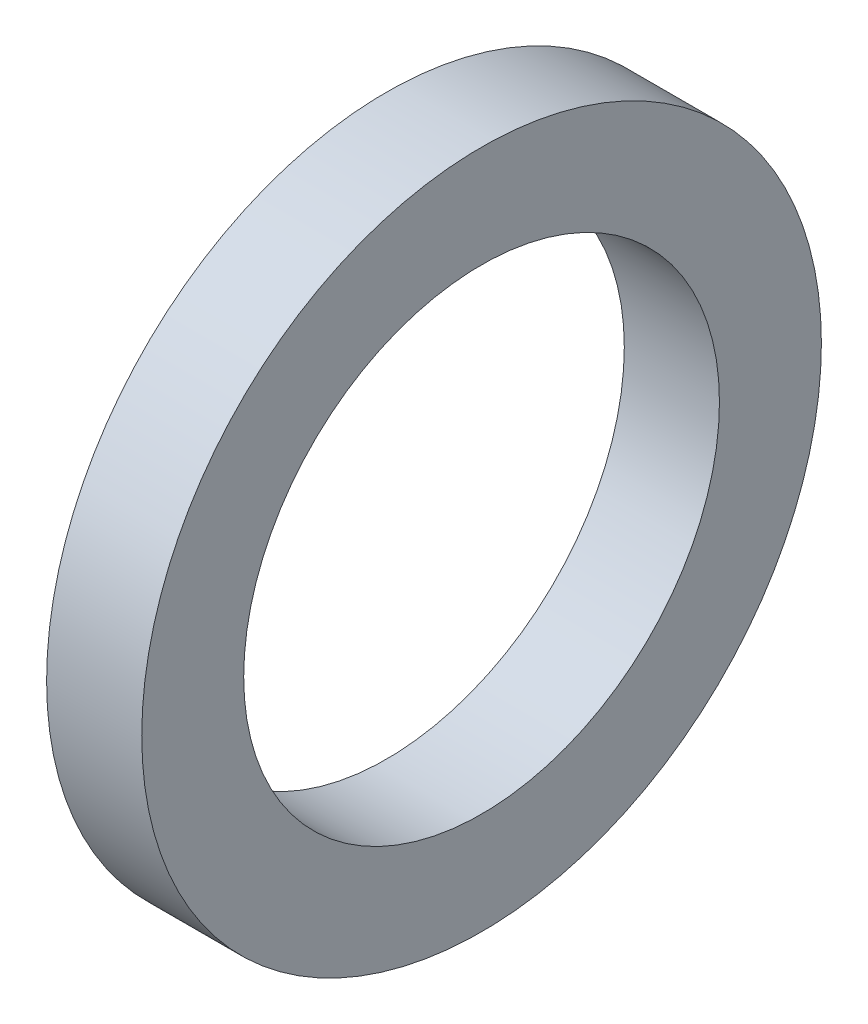
from build123d import *

# Parameters (mm, degrees)
SKETCH1_R           = 25
SKETCH1_R_2         = 17.5
BOSS_EXTRUDE1_DEPTH = 7


with BuildPart() as part:
    # Sketch1 → Boss-Extrude1 (new body)
    with BuildSketch(Plane(origin=(0, 0, 0), x_dir=(0, 0, -1), z_dir=(1, 0, 0))):
        Circle(SKETCH1_R)
        Circle(SKETCH1_R_2, mode=Mode.SUBTRACT)
    extrude(amount=BOSS_EXTRUDE1_DEPTH)


solid = part.part
